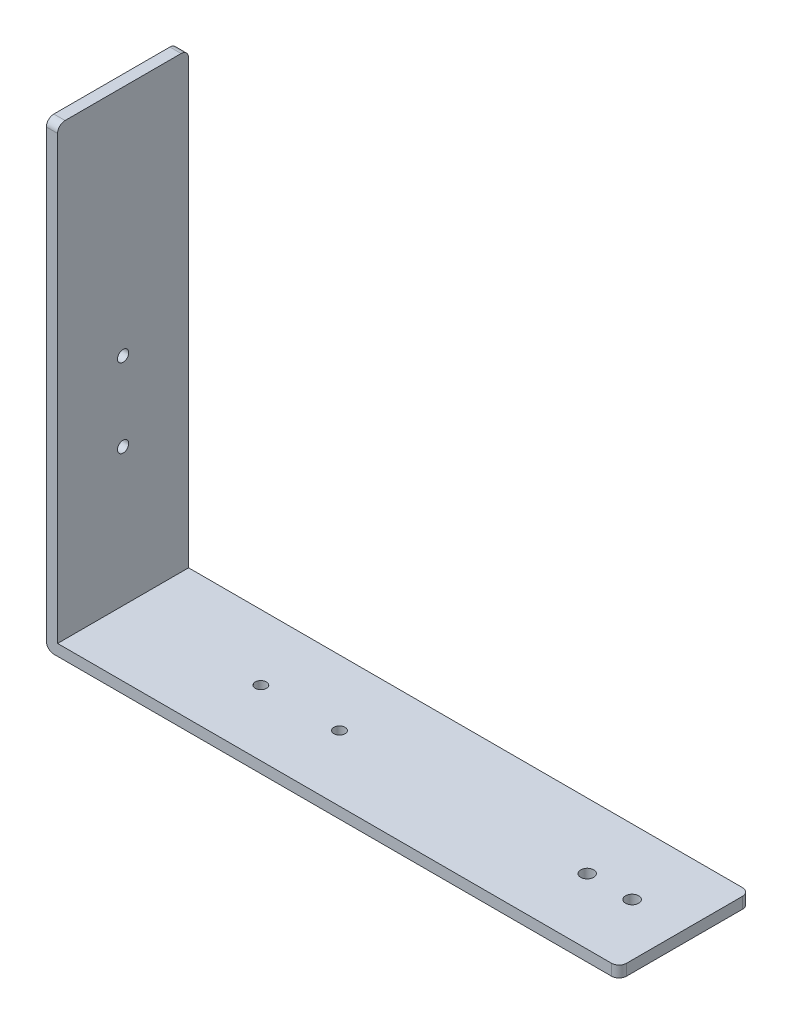
from build123d import *

# Parameters (mm, degrees)
EXTRU_MINCE1_DEPTH      = 35
ESQUISSE2_R             = 1.75
ENL_V_MAT_EXTRU_1_DEPTH = 10
CONG_1_R                = 2
ESQUISSE3_R             = 1.5
ENL_V_MAT_EXTRU_2_DEPTH = 10
ESQUISSE4_R             = 1.5
ENL_V_MAT_EXTRU_3_DEPTH = 10


with BuildPart() as part:
    # Esquisse1 → Extru.-Mince1 (new body)
    with BuildSketch(Plane.XY):
        Polygon((0, 120), (0, 0), (150, 0), (150, -3), (-3, -3), (-3, 120), align=None)
    extrude(amount=EXTRU_MINCE1_DEPTH)

    # Esquisse2 → Enlèv. mat.-Extru.1 (cut)
    with BuildSketch(Plane(origin=(0, 0, 0), x_dir=(1, 0, 0), z_dir=(0, 1, 0))):
        with Locations(Location((124, -17.5, 0), (0, 0, 270))):
            Circle(ESQUISSE2_R)
        with Locations(Location((136, -17.5, 0), (0, 0, 270))):
            Circle(ESQUISSE2_R)
    extrude(amount=-ENL_V_MAT_EXTRU_1_DEPTH, mode=Mode.SUBTRACT)

    # Congé1
    cong_1_edges = [part.edges().sort_by_distance(p)[0] for p in [
        (-1.5, 120, 35),
        (-1.5, 120, 0),
        (150, -1.5, 0),
        (150, -1.5, 35),
        (-3, -3, 17.5),
    ]]
    fillet(cong_1_edges, radius=CONG_1_R)

    # Esquisse3 → Enlèv. mat.-Extru.2 (cut)
    with BuildSketch(Plane(origin=(0, 0, 0), x_dir=(1, 0, 0), z_dir=(0, 1, 0))):
        with Locations(Location((36.8, -17.5, 0), (0, 0, 270))):
            Circle(ESQUISSE3_R)
        with Locations(Location((57.8, -17.5, 0), (0, 0, 270))):
            Circle(ESQUISSE3_R)
    extrude(amount=-ENL_V_MAT_EXTRU_2_DEPTH, mode=Mode.SUBTRACT)

    # Esquisse4 → Enlèv. mat.-Extru.3 (cut)
    with BuildSketch(Plane(origin=(0, 0, 0), x_dir=(0, 0, -1), z_dir=(1, 0, 0))):
        with Locations((-17.5, 36.8)):
            Circle(ESQUISSE4_R)
        with Locations((-17.5, 57.8)):
            Circle(ESQUISSE4_R)
    extrude(amount=-ENL_V_MAT_EXTRU_3_DEPTH, mode=Mode.SUBTRACT)


solid = part.part
